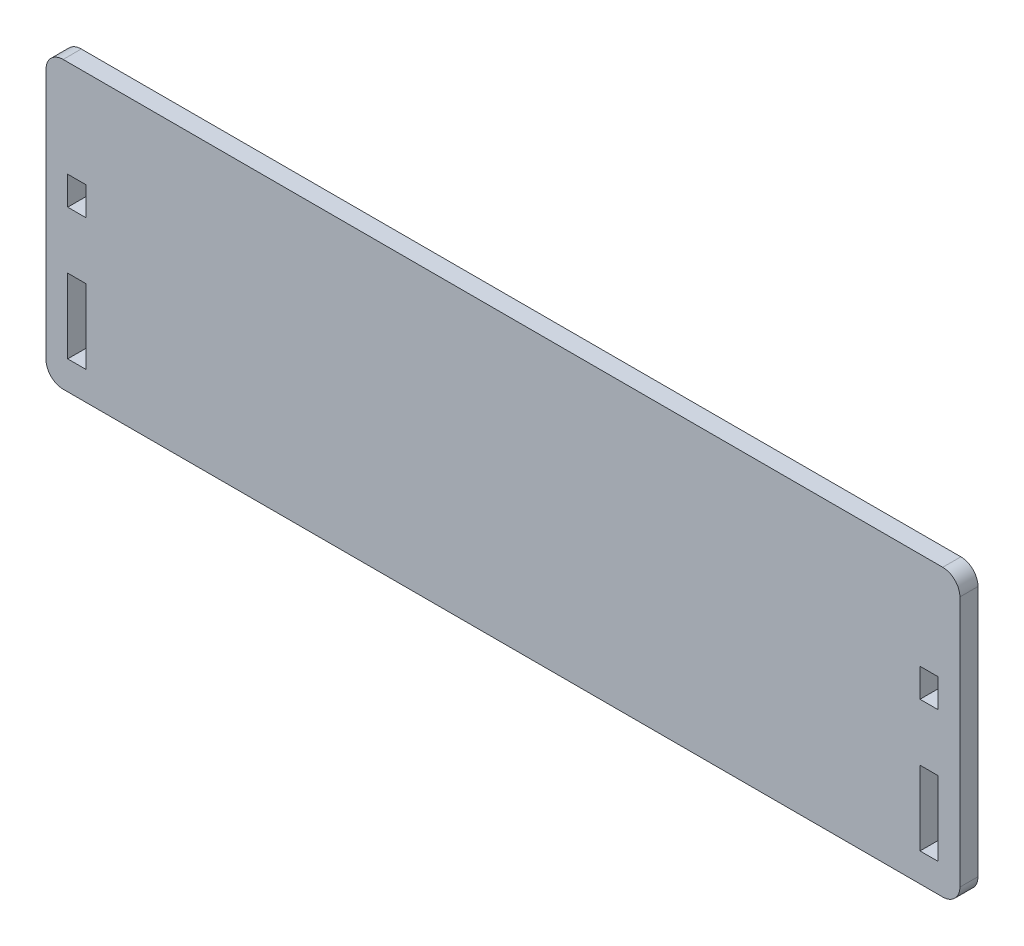
from build123d import *

# Parameters (mm, degrees)
SKETCH1_W           = 3.175
SKETCH1_H           = 13
SKETCH1_H_2         = 5
BOSS_EXTRUDE1_DEPTH = 3.175
FILLET2_R           = 3
FILLET3_R           = 3


with BuildPart() as part:
    # Sketch1 → Boss-Extrude1 (new body)
    with BuildSketch(Plane.XY):
        Polygon((-80, -25), (-76.2, -25), (76.2, -25), (80, -25), (80, 25), (-80, 25), (-80, 8), (-80, 3), (-80, -7), align=None)
        with Locations((-74.6125, -13.5)):
            Rectangle(SKETCH1_W, SKETCH1_H, mode=Mode.SUBTRACT)
        with Locations((74.6125, -13.5)):
            Rectangle(SKETCH1_W, SKETCH1_H, mode=Mode.SUBTRACT)
        with Locations((-74.6125, 5.5)):
            Rectangle(SKETCH1_W, SKETCH1_H_2, mode=Mode.SUBTRACT)
        with Locations((74.6125, 5.5)):
            Rectangle(SKETCH1_W, SKETCH1_H_2, mode=Mode.SUBTRACT)
    extrude(amount=BOSS_EXTRUDE1_DEPTH)

    # Fillet2
    fillet2_edges = [part.edges().sort_by_distance(p)[0] for p in [
        (-80, 25, 1.5875),
    ]]
    fillet(fillet2_edges, radius=FILLET2_R)

    # Fillet3
    fillet3_edges = [part.edges().sort_by_distance(p)[0] for p in [
        (80, -25, 1.5875),
        (-80, -25, 1.5875),
        (80, 25, 1.5875),
    ]]
    fillet(fillet3_edges, radius=FILLET3_R)


solid = part.part
